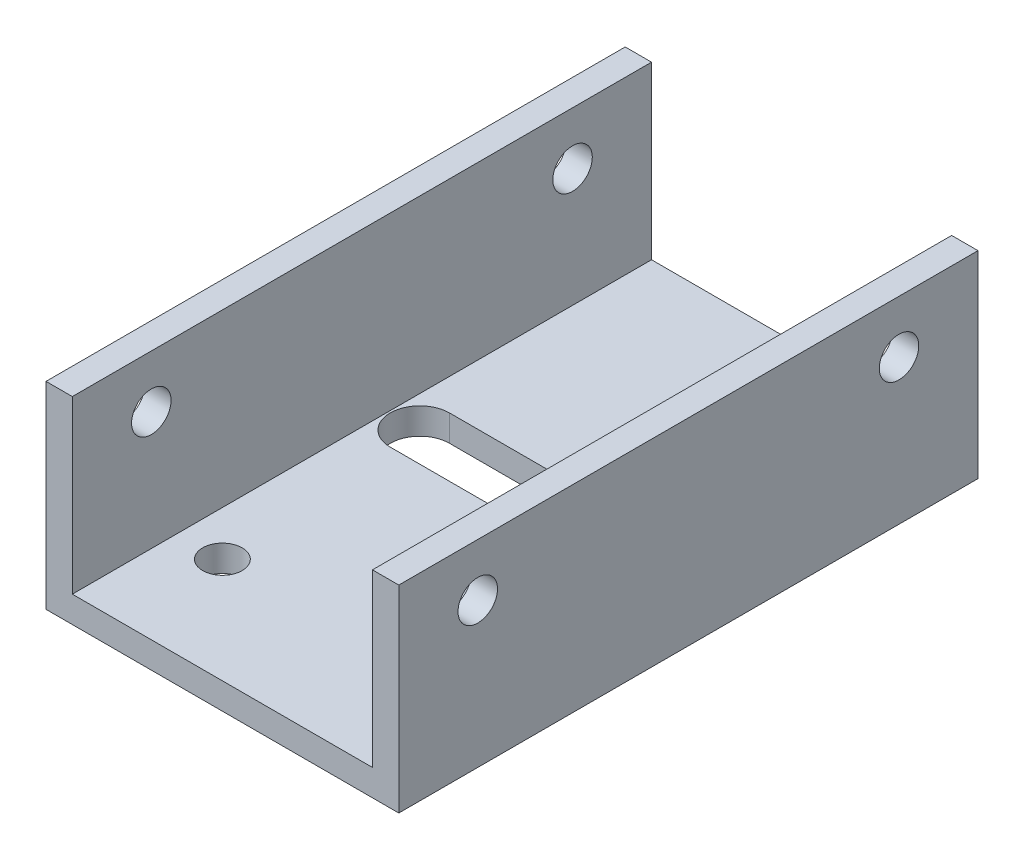
from build123d import *

# Parameters (mm, degrees)
BOSS_EXTRUDE1_DEPTH = 44
SKETCH3_R           = 1.5
CUT_EXTRUDE1_DEPTH  = 30
SKETCH4_R           = 1.5
CUT_EXTRUDE2_DEPTH  = 30


with BuildPart() as part:
    # Sketch2 → Boss-Extrude1 (new body)
    with BuildSketch(Plane.XY):
        Polygon((24.8, 15), (26.8, 15), (26.8, 0), (0, 0), (0, 15), (2, 15), (2, 2), (24.8, 2), align=None)
    extrude(amount=BOSS_EXTRUDE1_DEPTH)

    # Sketch3 → Cut-Extrude1 (cut)
    with BuildSketch(Plane.XZ):
        with Locations(Location((21.4, 36, 0), (0, 0, 270))):
            Circle(SKETCH3_R)
        with Locations(Location((13.4, 8, 0), (0, 0, 270))):
            Circle(SKETCH3_R)
        with Locations(Location((5.4, 36, 0), (0, 0, 270))):
            Circle(SKETCH3_R)
        with BuildLine():
            Line((22.4, 17.75), (4.4, 17.75))
            ThreePointArc((4.4, 17.75), (2.15, 20), (4.4, 22.25))
            Line((4.4, 22.25), (22.4, 22.25))
            ThreePointArc((22.4, 22.25), (24.65, 20), (22.4, 17.75))
        make_face()
    extrude(amount=-CUT_EXTRUDE1_DEPTH, mode=Mode.SUBTRACT)

    # Sketch4 → Cut-Extrude2 (cut)
    with BuildSketch(Plane.ZY):
        with Locations((6, 11)):
            Circle(SKETCH4_R)
        with Locations((38, 11)):
            Circle(SKETCH4_R)
    extrude(amount=-CUT_EXTRUDE2_DEPTH, mode=Mode.SUBTRACT)


solid = part.part
